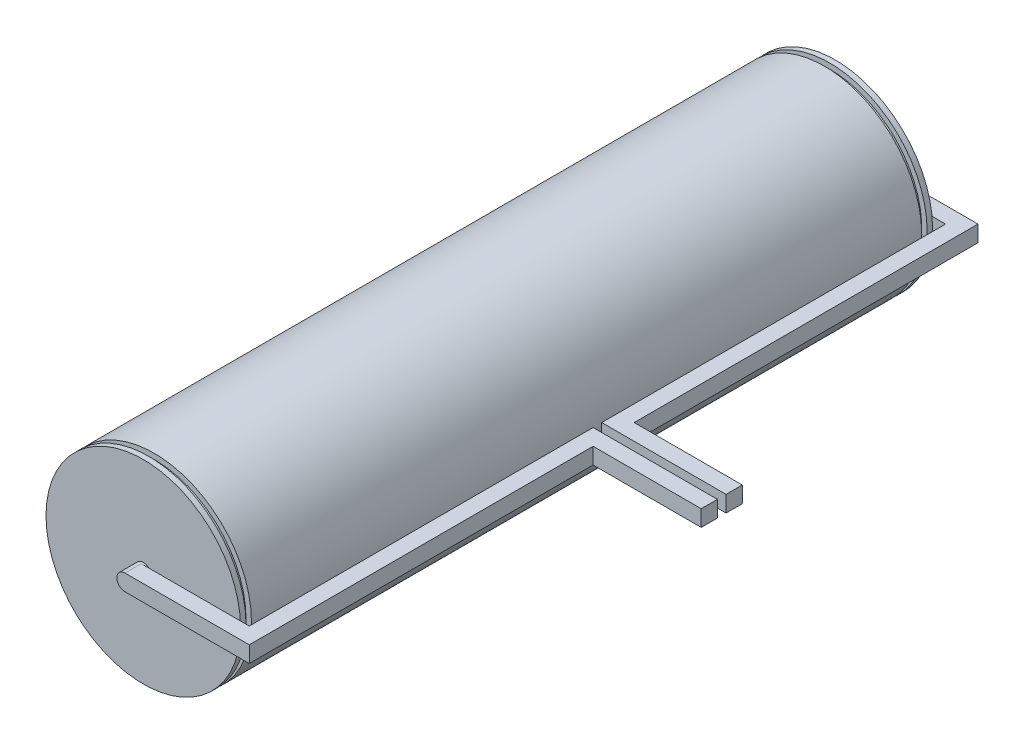
from build123d import *

# Parameters (mm, degrees)
ESQUISSE1_R         = 9
BOSS_EXTRU_1_DEPTH  = 31
ESQUISSE3_R         = 8.5
BOSS_EXTRU_2_DEPTH  = 0.5
BOSS_EXTRU_3_START  = 0.5
ESQUISSE4_R         = 9
BOSS_EXTRU_3_DEPTH  = 0.5
ESQUISSE5_R         = 0.75
BOSS_EXTRU_4_DEPTH  = 0.2
BOSS_EXTRU_5_DEPTH  = 1.5
ESQUISSE7_W         = 1.5
ESQUISSE7_H         = 1.5
BOSS_EXTRU_6_DEPTH  = 31.8
ESQUISSE8_W         = 1.5
ESQUISSE8_H         = 1.5
BOSS_EXTRU_7_DEPTH  = 10
ESQUISSE10_R        = 9
BOSS_EXTRU_8_DEPTH  = 31
BOSS_EXTRU_9_START  = 0.5
ESQUISSE11_R        = 8.5
BOSS_EXTRU_9_DEPTH  = 0.5
ESQUISSE12_R        = 9
BOSS_EXTRU_10_DEPTH = 0.5
BOSS_EXTRU_11_START = 0.2
ESQUISSE13_R        = 0.75
BOSS_EXTRU_11_DEPTH = 0.2
BOSS_EXTRU_12_START = 1.5
BOSS_EXTRU_12_DEPTH = 1.5
ESQUISSE16_W        = 1.5
ESQUISSE16_H        = 1.5
BOSS_EXTRU_13_DEPTH = 31.8
ESQUISSE17_W        = 1.5
ESQUISSE17_H        = 1.5
BOSS_EXTRU_14_DEPTH = 10


with BuildPart() as part:
    # Esquisse1 → Boss.-Extru.1 (new body)
    with BuildSketch(Plane.XY):
        Circle(ESQUISSE1_R)
    extrude(amount=BOSS_EXTRU_1_DEPTH)

    # Esquisse3 → Boss.-Extru.2 (add)
    with BuildSketch(Plane(origin=(0, 0, 0), x_dir=(-1, 0, 0), z_dir=(0, 0, -1))):
        Circle(ESQUISSE3_R)
    extrude(amount=BOSS_EXTRU_2_DEPTH)

    # Esquisse4 → Boss.-Extru.3 (add)
    with BuildSketch(Plane(origin=(0, 0, -0.5), x_dir=(-1, 0, 0), z_dir=(0, 0, -1)).offset(BOSS_EXTRU_3_START)):
        with Locations(Location((0, 0, 0), (0, 0, 180))):
            Circle(ESQUISSE4_R)
    extrude(amount=-BOSS_EXTRU_3_DEPTH)

    # Esquisse5 → Boss.-Extru.4 (add)
    with BuildSketch(Plane(origin=(0, 0, -1), x_dir=(-1, 0, 0), z_dir=(0, 0, -1))):
        Circle(ESQUISSE5_R)
    extrude(amount=BOSS_EXTRU_4_DEPTH)

    # Esquisse6 → Boss.-Extru.5 (add)
    with BuildSketch(Plane(origin=(0, 0, -1.2), x_dir=(-1, 0, 0), z_dir=(0, 0, -1))):
        with BuildLine():
            Line((-11.5, -0.75), (0, -0.75))
            ThreePointArc((0, -0.75), (-0.75, 0), (0, 0.75))
            Line((0, 0.75), (-11.5, 0.75))
            Line((-11.5, 0.75), (-11.5, -0.75))
        make_face()
        with BuildLine():
            ThreePointArc((0, 0.75), (-0.75, 0), (0, -0.75))
            Line((0, -0.75), (0, 0.75))
        make_face()
        with BuildLine():
            Line((0, 0.75), (0, -0.75))
            ThreePointArc((0, -0.75), (0.530330086, -0.530330086), (0.75, 0))
            ThreePointArc((0.75, 0), (0.530330086, 0.530330086), (0, 0.75))
        make_face()
    extrude(amount=BOSS_EXTRU_5_DEPTH)

    # Esquisse7 → Boss.-Extru.6 (add)
    with BuildSketch(Plane.XY.offset(-1.2)):
        with Locations((10.75, 0)):
            Rectangle(ESQUISSE7_W, ESQUISSE7_H)
    extrude(amount=BOSS_EXTRU_6_DEPTH)

    # Esquisse8 → Boss.-Extru.7 (add)
    with BuildSketch(Plane(origin=(11.5, 0, 0), x_dir=(0, 0, -1), z_dir=(1, 0, 0))):
        with Locations((-29.85, 0)):
            Rectangle(ESQUISSE8_W, ESQUISSE8_H)
    extrude(amount=BOSS_EXTRU_7_DEPTH)

    # Esquisse10 → Boss.-Extru.8 (add)
    with BuildSketch(Plane.XY.offset(31)):
        Circle(ESQUISSE10_R)
    extrude(amount=BOSS_EXTRU_8_DEPTH)

    # Esquisse11 → Boss.-Extru.9 (add)
    with BuildSketch(Plane.XY.offset(62).offset(BOSS_EXTRU_9_START)):
        with Locations(Location((0, 0, 0), (0, 0, 180))):
            Circle(ESQUISSE11_R)
    extrude(amount=-BOSS_EXTRU_9_DEPTH)

    # Esquisse12 → Boss.-Extru.10 (add)
    with BuildSketch(Plane.XY.offset(62.5)):
        Circle(ESQUISSE12_R)
    extrude(amount=BOSS_EXTRU_10_DEPTH)

    # Esquisse13 → Boss.-Extru.11 (add)
    with BuildSketch(Plane.XY.offset(63).offset(BOSS_EXTRU_11_START)):
        with Locations(Location((0, 0, 0), (0, 0, 90))):
            Circle(ESQUISSE13_R)
    extrude(amount=-BOSS_EXTRU_11_DEPTH)

    # Esquisse15 → Boss.-Extru.12 (add)
    with BuildSketch(Plane.XY.offset(63.2).offset(BOSS_EXTRU_12_START)):
        with BuildLine():
            ThreePointArc((0.75, 0), (0.530330086, -0.530330086), (0, -0.75))
            Line((0, -0.75), (11.5, -0.75))
            Line((11.5, -0.75), (11.5, 0.75))
            Line((11.5, 0.75), (0, 0.75))
            ThreePointArc((0, 0.75), (0.530330086, 0.530330086), (0.75, 0))
        make_face()
        with BuildLine():
            ThreePointArc((0, 0.75), (-0.75, 0), (0, -0.75))
            Line((0, -0.75), (0, 0.75))
        make_face()
        with BuildLine():
            Line((0, 0.75), (0, -0.75))
            ThreePointArc((0, -0.75), (0.530330086, -0.530330086), (0.75, 0))
            ThreePointArc((0.75, 0), (0.530330086, 0.530330086), (0, 0.75))
        make_face()
    extrude(amount=-BOSS_EXTRU_12_DEPTH)

    # Esquisse16 → Boss.-Extru.13 (add)
    with BuildSketch(Plane(origin=(0, 0, 63.2), x_dir=(-1, 0, 0), z_dir=(0, 0, -1))):
        with Locations((-10.75, 0)):
            Rectangle(ESQUISSE16_W, ESQUISSE16_H)
    extrude(amount=BOSS_EXTRU_13_DEPTH)

    # Esquisse17 → Boss.-Extru.14 (add)
    with BuildSketch(Plane(origin=(11.5, 0, 0), x_dir=(0, 0, -1), z_dir=(1, 0, 0))):
        with Locations((-32.15, 0)):
            Rectangle(ESQUISSE17_W, ESQUISSE17_H)
    extrude(amount=BOSS_EXTRU_14_DEPTH)


solid = part.part
